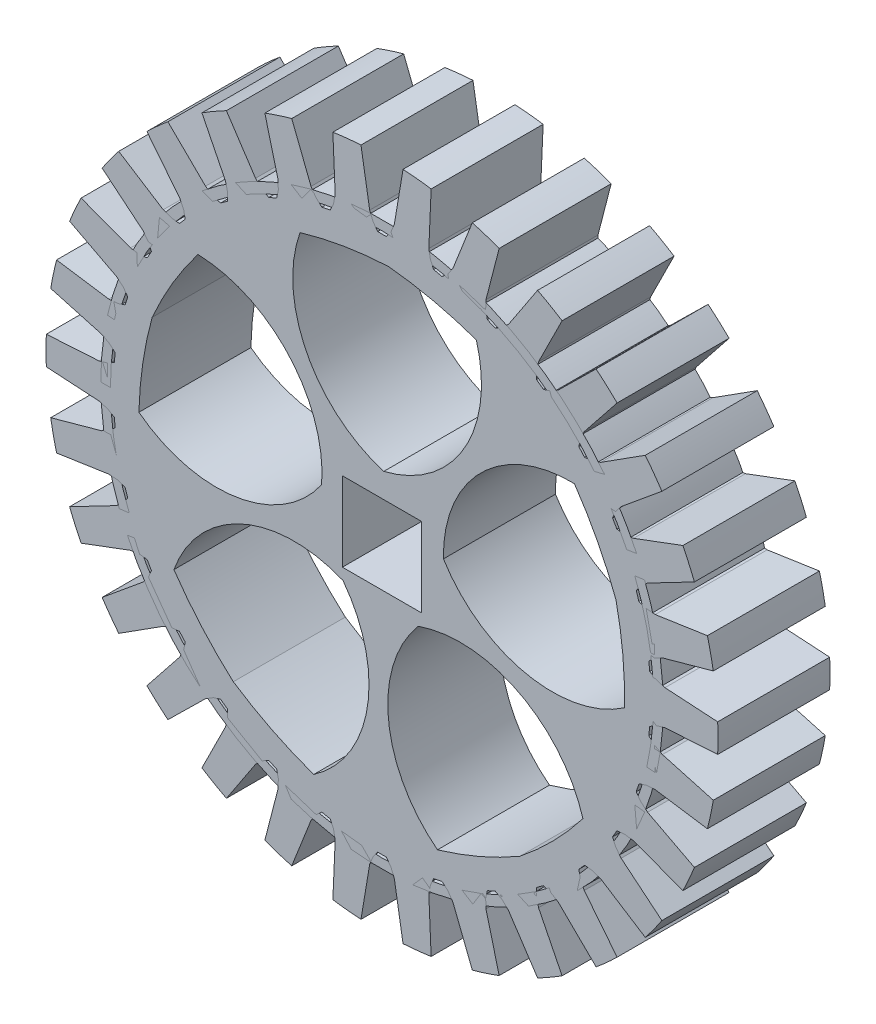
from build123d import *

# Parameters (mm, degrees)
SKETCH1_R           = 30
SKETCH1_W           = 7.071067812
SKETCH1_H           = 7.071067812
BOSS_EXTRUDE1_DEPTH = 10
CUT_EXTRUDE1_DEPTH  = 44.588989435
CIRPATTERN1_COUNT   = 30
CUT_EXTRUDE2_DEPTH  = 44.54851152
SKETCH5_R           = 25.109802293
SKETCH5_R_2         = 24.249619568
BOSS_EXTRUDE2_DEPTH = 10
CIRPATTERN2_COUNT   = 5


with BuildPart() as part:
    # Sketch1 → Boss-Extrude1 (new body)
    with BuildSketch(Plane.XY):
        Circle(SKETCH1_R)
        Rectangle(SKETCH1_W, SKETCH1_H, mode=Mode.SUBTRACT)
    extrude(amount=BOSS_EXTRUDE1_DEPTH)

    # Sketch2 → Cut-Extrude1 (cut, through all)
    with BuildSketch(Plane.XY):
        Polygon((0, 23.99523661), (-0.383566179, 23.99523661), (-0.793201221, 24.541416665), (-1.100427501, 25.292414241), (-1.878069315, 29.941156552), (-2.704831412, 31.266258591), (0, 31.778302392), (2.704831412, 31.266258591), (1.878069315, 29.941156552), (1.100427501, 25.292414241), (0.793201221, 24.541416665), (0.383566179, 23.99523661), align=None)
    cut_extrude1 = extrude(amount=CUT_EXTRUDE1_DEPTH, mode=Mode.SUBTRACT)

    # CirPattern1: Cut-Extrude1 ×30 about axis
    cirpattern1_axis = Axis((0, 0, 0), (0, 0, 1))
    for i in range(1, CIRPATTERN1_COUNT):
        add(cut_extrude1.rotate(cirpattern1_axis, i * 360 / CIRPATTERN1_COUNT), mode=Mode.SUBTRACT)

    # Sketch4 → Cut-Extrude2 (cut, symmetric)
    with BuildSketch(Plane.XY):
        with BuildLine():
            ThreePointArc((0.155864103, 5.718264267), (-6.734235557, 11.483203455), (-7.319495159, 20.447882387))
            ThreePointArc((-7.319495159, 20.447882387), (-3.403377579, 21.350827464), (0.593426951, 21.771351258))
            ThreePointArc((0.593426951, 21.771351258), (4.561389364, 21.133729898), (8.422505211, 20.018798901))
            ThreePointArc((8.422505211, 20.018798901), (7.349772612, 11.099312261), (0.155864103, 5.718264267))
        make_face()
    cut_extrude2 = extrude(amount=CUT_EXTRUDE2_DEPTH, both=True, mode=Mode.SUBTRACT)

    # CirPattern2: Cut-Extrude2 ×5 about axis
    cirpattern2_axis = Axis((0, 0, 0), (0, 0, 1))
    for i in range(1, CIRPATTERN2_COUNT):
        add(cut_extrude2.rotate(cirpattern2_axis, i * 360 / CIRPATTERN2_COUNT), mode=Mode.SUBTRACT)


with BuildPart() as body_2:
    # Sketch5 → Boss-Extrude2 (new body)
    with BuildSketch(Plane.XY):
        Circle(SKETCH5_R)
        Circle(SKETCH5_R_2, mode=Mode.SUBTRACT)
    extrude(amount=BOSS_EXTRUDE2_DEPTH)


solid = Compound([part.part, body_2.part])
